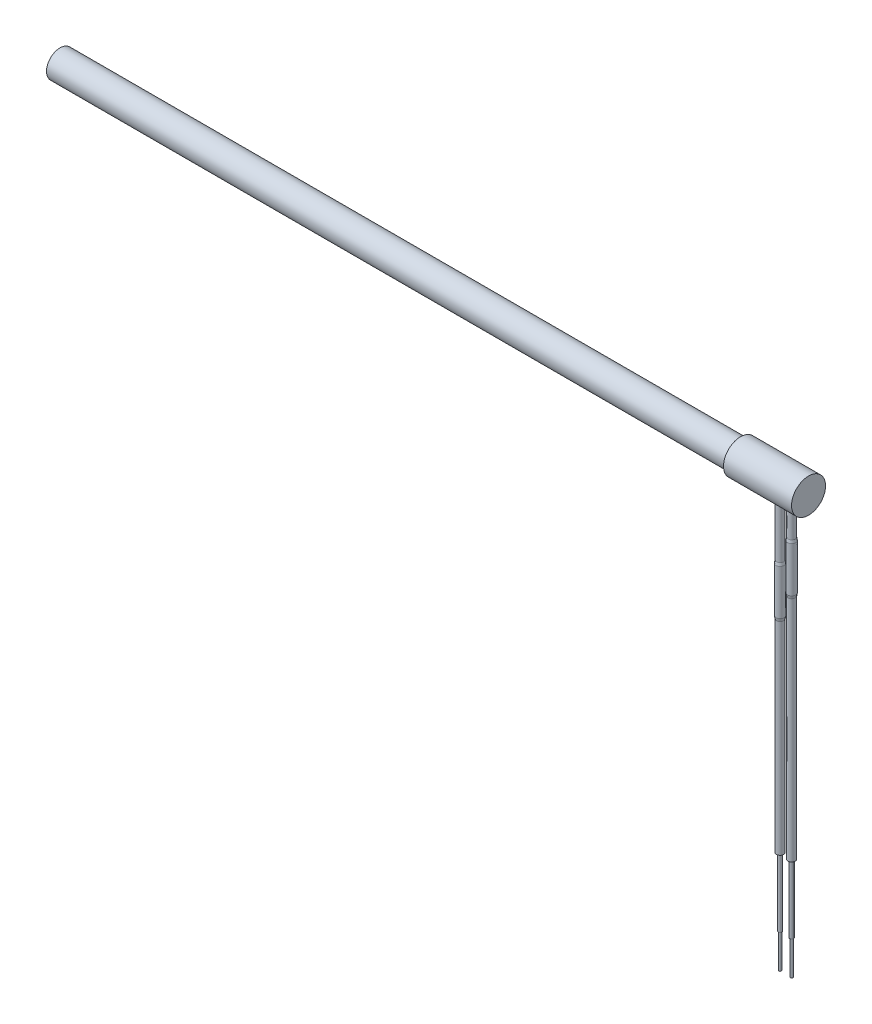
from build123d import *

# Parameters (mm, degrees)
LPATTERN1_COUNT = 2
LPATTERN1_PITCH = 3.4


with BuildPart() as part:
    # Sketch1 → Revolve1 (revolve)
    with BuildSketch(Plane.XY, mode=Mode.PRIVATE) as revolve1_sk:
        Polygon((0, 4), (0, 5), (20, 5), (20, 0), (-200, 0), (-200, 4), align=None)
    revolve(revolve1_sk.sketch.rotate(Axis((-200, 0, 0), (1, 0, 0)), 90), axis=Axis((-200, 0, 0), (1, 0, 0)))

    # Sketch2 → Revolve2 (revolve)
    with BuildSketch(Plane.XY, mode=Mode.PRIVATE) as revolve2_sk:
        Polygon((15.405, -125), (15.405, -115), (15.58, -115), (15.58, -95), (16.08, -95), (16.08, 0), (15.03, 0), (15.03, -125), align=None)
    revolve2 = revolve(revolve2_sk.sketch.rotate(Axis((15.03, 0, 0), (0, -1, 0)), 180), axis=Axis((15.03, 0, 0), (0, -1, 0)))

    # LPattern1: Revolve2 ×2
    with Locations(*[(-i * LPATTERN1_PITCH, 0, 0) for i in range(1, LPATTERN1_COUNT)]):
        add(revolve2)

    # Sketch3 → Revolve3 (revolve)
    with BuildSketch(Plane.XY, mode=Mode.PRIVATE) as revolve3_sk:
        Polygon((15.03, -13), (16.08, -13), (16.23, -13.850692273), (16.23, -27.149307727), (16.08, -28), (15.03, -28), align=None)
    revolve(revolve3_sk.sketch.rotate(Axis((15.03, -13, 0), (0, -1, 0)), 180), axis=Axis((15.03, -13, 0), (0, -1, 0)))

    # Sketch4 → Revolve4 (revolve)
    with BuildSketch(Plane.XY, mode=Mode.PRIVATE) as revolve4_sk:
        Polygon((11.63, -20.5), (12.68, -20.5), (12.83, -21.350692273), (12.83, -34.649307727), (12.68, -35.5), (11.63, -35.5), align=None)
    revolve(revolve4_sk.sketch.rotate(Axis((11.63, -20.5, 0), (0, -1, 0)), 180), axis=Axis((11.63, -20.5, 0), (0, -1, 0)))


solid = part.part
